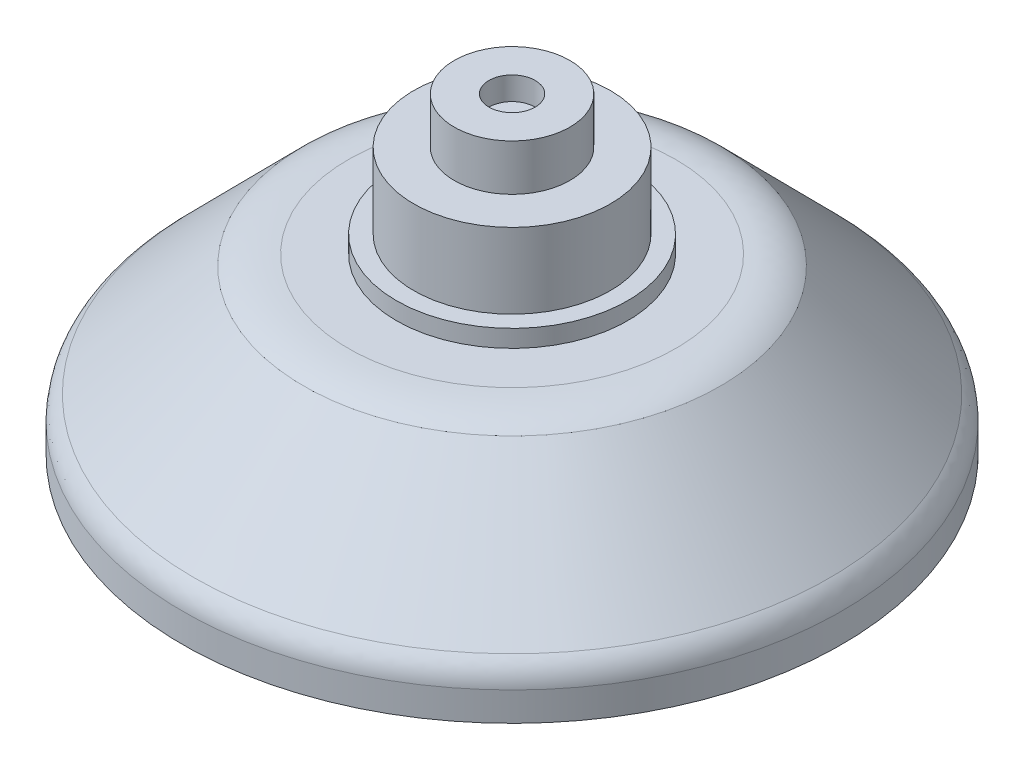
from build123d import *

# Parameters (mm, degrees)
SKETCH_1_W          = 5
SKETCH_1_H          = 4
SKETCH_2_R          = 28.5
EXTRUDE_1_DEPTH     = 2.5
SKETCH_3_R          = 2
CUT_EXTRUDE_1_DEPTH = 2


with BuildPart() as part:
    # 草图1 → 旋转1 (revolve)
    with BuildSketch(Plane.XY, mode=Mode.PRIVATE) as revolve_1_sk:
        with Locations((2.5, 22.5)):
            Rectangle(SKETCH_1_W, SKETCH_1_H)
        Polygon((0, 20.5), (0, 14), (8.5, 14), (8.5, 20.5), (5, 20.5), align=None)
        Polygon((0, 14), (0, 12.5), (10, 12.5), (10, 14), (8.5, 14), align=None)
        with BuildLine():
            Line((0, 12.5), (0, 11.6))
            Line((0, 11.6), (18, 11.6))
            add(Edge.make_bspline(
                [(18, 11.6), (16.79764846, 12.364408857), (15.52083483, 12.5), (14.156281908, 12.5)],
                knots=[0, 0, 0, 0, 1, 1, 1, 1], degree=3))
            Line((14.156281908, 12.5), (10, 12.5))
            Line((10, 12.5), (0, 12.5))
        make_face()
        Polygon((0, 11.6), (0, 2.006476073), (27.5, 2.006476073), (18, 11.6), align=None)
        with BuildLine():
            Line((0, 2.006476073), (0, 0))
            Line((0, 0), (28.5, 0))
            add(Edge.make_bspline(
                [(28.5, 0), (28.41881975, 1.211999363), (27.5, 2.006476073)],
                knots=[0, 0, 0, 1, 1, 1], degree=2))
            Line((27.5, 2.006476073), (0, 2.006476073))
        make_face()
    revolve(revolve_1_sk.sketch.rotate(Axis((0, 0, 0), (0, 1, 0)), 90), axis=Axis((0, 0, 0), (0, 1, 0)))

    # 草图2 → 凸台-拉伸1 (add)
    with BuildSketch(Plane.XZ):
        with Locations(Location((0, 0, 0), (0, 0, 270))):
            Circle(SKETCH_2_R)
    extrude(amount=EXTRUDE_1_DEPTH)

    # 草图3 → 切除-拉伸1 (cut)
    with BuildSketch(Plane(origin=(0, 24.5, 0), x_dir=(1, 0, 0), z_dir=(0, 1, 0))):
        with Locations(Location((0, 0, 0), (0, 0, 270))):
            Circle(SKETCH_3_R)
    extrude(amount=-CUT_EXTRUDE_1_DEPTH, mode=Mode.SUBTRACT)


solid = part.part
